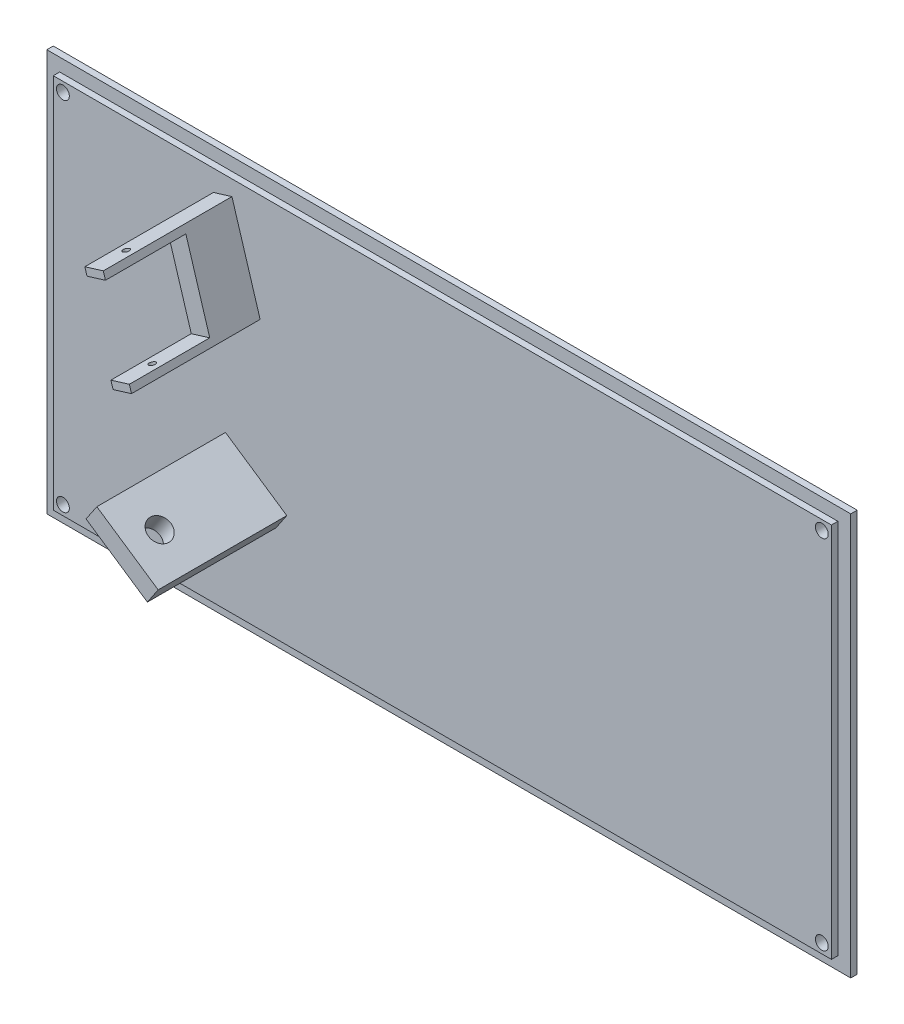
from build123d import *

# Parameters (mm, degrees)
SKIZZE1_W                       = 250
SKIZZE1_H                       = 125
AUFSATZ_LINEAR_AUSTRAGEN1_DEPTH = 2
SKIZZE2_W                       = 242
SKIZZE2_H                       = 117
AUFSATZ_LINEAR_AUSTRAGEN2_DEPTH = 2
SKIZZE3_R                       = 2
SCHNITT_LINEAR_AUSTRAGEN1_DEPTH = 32
AUFSATZ_LINEAR_AUSTRAGEN3_DEPTH = 40
SCHNITT_LINEAR_AUSTRAGEN2_DEPTH = 25
SKIZZE8_R                       = 1
SCHNITT_LINEAR_AUSTRAGEN3_DEPTH = 40
SKIZZE9_R                       = 3.493135661
SCHNITT_LINEAR_AUSTRAGEN4_DEPTH = 20


with BuildPart() as part:
    # Skizze1 → Aufsatz-Linear austragen1 (new body)
    with BuildSketch(Plane.XY):
        with Locations((125, 62.5)):
            Rectangle(SKIZZE1_W, SKIZZE1_H)
    extrude(amount=AUFSATZ_LINEAR_AUSTRAGEN1_DEPTH)

    # Skizze2 → Aufsatz-Linear austragen2 (add)
    with BuildSketch(Plane.XY.offset(2)):
        with Locations((125, 62.5)):
            Rectangle(SKIZZE2_W, SKIZZE2_H)
    extrude(amount=AUFSATZ_LINEAR_AUSTRAGEN2_DEPTH)

    # Skizze3 → Schnitt-Linear austragen1 (cut)
    with BuildSketch(Plane.XY.offset(4)):
        with Locations((7, 118)):
            Circle(SKIZZE3_R)
        with Locations((7, 7)):
            Circle(SKIZZE3_R)
        with Locations((243, 7)):
            Circle(SKIZZE3_R)
        with Locations((243, 118)):
            Circle(SKIZZE3_R)
    extrude(amount=-SCHNITT_LINEAR_AUSTRAGEN1_DEPTH, mode=Mode.SUBTRACT)

    # Skizze4 → Aufsatz-Linear austragen3 (add)
    with BuildSketch(Plane.XY.offset(4)):
        Polygon((62.595258591, 85.778313546), (68.333087126, 87.532543775), (59.561935985, 116.221686454), (53.824107449, 114.467456225), align=None)
        Polygon((54.200560001, 46.732563956), (73.26842417, 33.871127177), (76.623581591, 38.845352612), (57.555717422, 51.706789392), align=None)
    extrude(amount=AUFSATZ_LINEAR_AUSTRAGEN3_DEPTH)

    # Skizze7 → Schnitt-Linear austragen2 (cut)
    with BuildSketch(Plane.XY.offset(44)):
        Polygon((54.49656237, 112.267955287), (60.234390906, 114.022185515), (67.660632206, 89.732044713), (61.92280367, 87.977814485), align=None)
    extrude(amount=-SCHNITT_LINEAR_AUSTRAGEN2_DEPTH, mode=Mode.SUBTRACT)

    # Skizze8 → Schnitt-Linear austragen3 (cut)
    with BuildSketch(Plane(origin=(-27.403744567, 89.633609675, 0), x_dir=(0.9563047559630352, 0.2923717047227376, 0), z_dir=(-0.29237170472273766, 0.9563047559630353, 0))):
        with Locations(Location((87.939295251, -34, 0), (0, 0, 180))):
            Circle(SKIZZE8_R)
    extrude(amount=-SCHNITT_LINEAR_AUSTRAGEN3_DEPTH, mode=Mode.SUBTRACT)

    # Skizze9 → Schnitt-Linear austragen4 (cut)
    with BuildSketch(Plane(origin=(41.968333241, 62.220612777, 0), x_dir=(0.8290375725550413, -0.5591929034707476, 0), z_dir=(0.5591929034707476, 0.8290375725550413, 0))):
        with Locations(Location((30.301782569, -34, 0), (0, 0, 180))):
            Circle(SKIZZE9_R)
    extrude(amount=-SCHNITT_LINEAR_AUSTRAGEN4_DEPTH, mode=Mode.SUBTRACT)


solid = part.part
